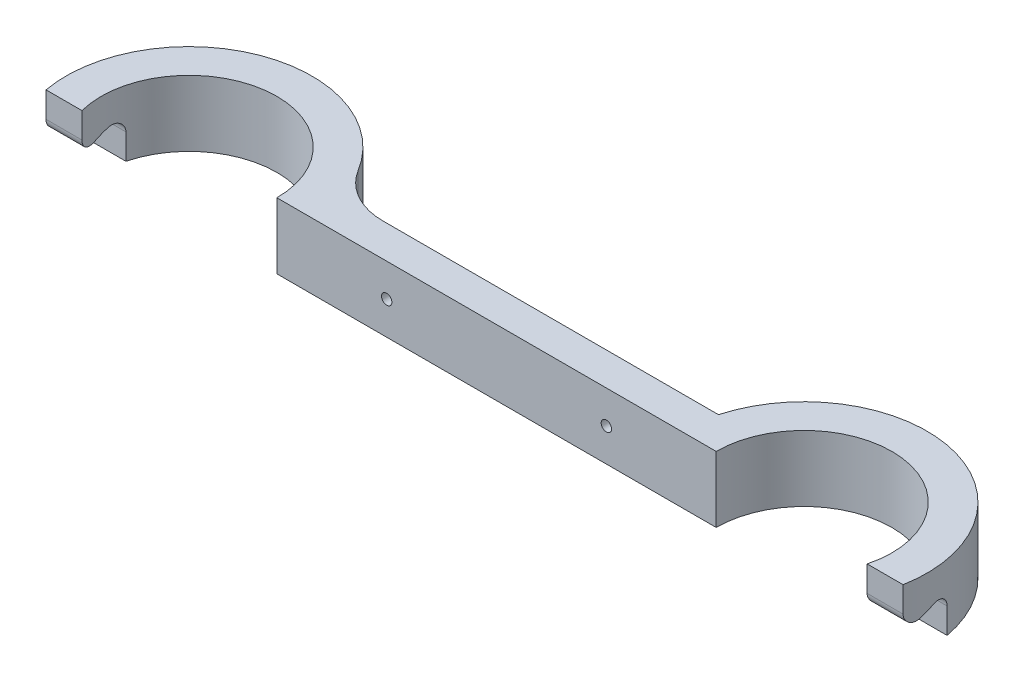
from build123d import *

# Parameters (mm, degrees)
BOSS_EXTRUDE1_DEPTH            = 19.05
FILLET1_R                      = 19.05
SKETCH2_R                      = 1.5
CUT_EXTRUDE1_DEPTH             = 129.572996096
BOSS_EXTRUDE2_REACH            = 132.835
BOSS_EXTRUDE2_END_RADIUS       = 25.4
CUT_EXTRUDE3_REACH             = 132.835
CUT_EXTRUDE3_DIRECTION_2_DEPTH = 131.83465787
CUT_EXTRUDE2_DEPTH             = 131.83465787
CUT_EXTRUDE2_DEPTH_BACK        = 131.83465787
FILLET2_R                      = 3.175
FILLET2_OF_MIRROR1_R           = 3.175
CUT_EXTRUDE4_DEPTH             = 131.834658007
CUT_EXTRUDE4_DEPTH_BACK        = 131.834658007


with BuildPart() as part:
    # Sketch1 → Boss-Extrude1 (new body)
    with BuildSketch(Plane(origin=(0, 0, 0), x_dir=(1, 0, 0), z_dir=(0, 1, 0))):
        with BuildLine():
            ThreePointArc((-54.639410761, 9.525), (-93.706612459, 35.233649778), (-124.46, 0))
            Line((-124.46, 0), (-114.3, 0))
            ThreePointArc((-114.3, 0), (-88.9, 25.4), (-63.5, 0))
            Line((-63.5, 0), (-53.34, 0))
            ThreePointArc((-53.34, 0), (-53.666350222, 4.806612459), (-54.639410761, 9.525))
        make_face()
        with BuildLine():
            Line((-53.34, 0), (0, 0))
            Line((0, 0), (0, 9.525))
            Line((0, 9.525), (-54.639410761, 9.525))
            ThreePointArc((-54.639410761, 9.525), (-53.666350222, 4.806612459), (-53.34, 0))
        make_face()
    boss_extrude1 = extrude(amount=BOSS_EXTRUDE1_DEPTH)

    # Fillet1
    fillet1_edges = [part.edges().sort_by_distance(p)[0] for p in [
        (-54.639410761, 9.525, -9.525),
    ]]
    fillet(fillet1_edges, radius=FILLET1_R)

    # Sketch2 → Cut-Extrude1 (cut, symmetric)
    with BuildSketch(Plane(origin=(0, 0, -9.525), x_dir=(-1, 0, 0), z_dir=(0, 0, -1))):
        with Locations((31.75, 9.525)):
            Circle(SKETCH2_R)
    cut_extrude1 = extrude(amount=CUT_EXTRUDE1_DEPTH, both=True, mode=Mode.SUBTRACT)

    # Boss-Extrude2: up to this cylinder (the profile starts outside it)
    boss_extrude2_end = Plane(origin=(-88.9, 11.6227675, 0), z_dir=(0, -1, 0)) * Cylinder(BOSS_EXTRUDE2_END_RADIUS, 323.358869, mode=Mode.PRIVATE)
    # Sketch3 → Boss-Extrude2 (add, up to the surface)
    with BuildSketch(Plane.ZY.offset(124.46), mode=Mode.PRIVATE) as boss_extrude2_sk1:
        Polygon((6.35, 19.05), (-6.35, 19.05), (-6.35, 12.065), (0, 9.525), (6.35, 9.525), align=None)
    boss_extrude2_tool1 = extrude(boss_extrude2_sk1.sketch, amount=-BOSS_EXTRUDE2_REACH, mode=Mode.PRIVATE) - boss_extrude2_end
    # Sketch3 → Boss-Extrude2 (add, up to the surface)
    with BuildSketch(Plane.ZY.offset(124.46), mode=Mode.PRIVATE) as boss_extrude2_sk2:
        Polygon((6.35, 6.985), (6.35, 9.525), (0, 9.525), align=None)
    boss_extrude2_tool2 = extrude(boss_extrude2_sk2.sketch, amount=-BOSS_EXTRUDE2_REACH, mode=Mode.PRIVATE) - boss_extrude2_end
    boss_extrude2 = boss_extrude2_tool1.solids().sort_by_distance((-124.46, 14.567202, 0.302381))[0] + boss_extrude2_tool2.solids().sort_by_distance((-124.46, 8.678333, 4.233333))[0]
    add(boss_extrude2)

    # Sketch3<3> → Cut-Extrude3 (cut, up to next)
    with BuildSketch(Plane.ZY.offset(124.46), mode=Mode.PRIVATE) as cut_extrude3_sk1:
        Polygon((-6.35, 0), (6.35, 0), (6.35, 6.985), (-6.35, 12.065), align=None)
    cut_extrude3_tool1 = extrude(cut_extrude3_sk1.sketch, amount=-CUT_EXTRUDE3_REACH, mode=Mode.PRIVATE) & part.part
    cut_extrude3 = cut_extrude3_tool1.solids().sort_by_distance((-124.46, 4.875389, -0.564444))[0]
    add(cut_extrude3, mode=Mode.SUBTRACT)

    # Sketch3<3> → Cut-Extrude3 direction 2 (cut)
    with BuildSketch(Plane.ZY.offset(124.46)):
        Polygon((-6.35, 0), (6.35, 0), (6.35, 6.985), (-6.35, 12.065), align=None)
    cut_extrude3_direction_2 = extrude(amount=CUT_EXTRUDE3_DIRECTION_2_DEPTH, mode=Mode.SUBTRACT)

    # Sketch4 → Cut-Extrude2 (cut, two sides: drawn at the far end of the back side and taken through both)
    with BuildSketch(Plane(origin=(0, 19.05, 0), x_dir=(1, 0, 0), z_dir=(0, 1, 0)).offset(-CUT_EXTRUDE2_DEPTH_BACK)):
        with BuildLine():
            Line((-124.46, -6.35), (-123.888442377, -6.35))
            ThreePointArc((-123.888442377, -6.35), (-124.316822351, -3.187835399), (-124.46, -2e-09))
            Line((-124.46, -2e-09), (-124.46, -6.35))
        make_face()
        with BuildLine():
            ThreePointArc((-124.46, -2e-09), (-124.316822351, 3.187835398), (-123.888442377, 6.35))
            Line((-123.888442377, 6.35), (-124.46, 6.35))
            Line((-124.46, 6.35), (-124.46, -2e-09))
        make_face()
    extrude(amount=CUT_EXTRUDE2_DEPTH + CUT_EXTRUDE2_DEPTH_BACK, mode=Mode.SUBTRACT)

    # Fillet2
    fillet2_edges = [part.edges().sort_by_distance(p)[0] for p in [
        (-118.690943313, 6.985, 6.35),
        (-118.690943313, 12.065, -6.35),
    ]]
    fillet(fillet2_edges, radius=FILLET2_R)

    # Mirror1: Boss-Extrude1, Cut-Extrude1, Boss-Extrude2, Cut-Extrude3, Cut-Extrude3 direction 2 across plane
    add(boss_extrude1.mirror(Plane(origin=(0, 19.05, 0), x_dir=(0, 0, 1), z_dir=(1, 0, 0))))
    add(cut_extrude1.mirror(Plane(origin=(0, 19.05, 0), x_dir=(0, 0, 1), z_dir=(1, 0, 0))), mode=Mode.SUBTRACT)
    add(boss_extrude2.mirror(Plane(origin=(0, 19.05, 0), x_dir=(0, 0, 1), z_dir=(1, 0, 0))))
    add(cut_extrude3.mirror(Plane(origin=(0, 19.05, 0), x_dir=(0, 0, 1), z_dir=(1, 0, 0))), mode=Mode.SUBTRACT)
    add(cut_extrude3_direction_2.mirror(Plane(origin=(0, 19.05, 0), x_dir=(0, 0, 1), z_dir=(1, 0, 0))), mode=Mode.SUBTRACT)

    # Fillet2 of Mirror1
    fillet2_of_mirror1_edges = [part.edges().sort_by_distance(p)[0] for p in [
        (118.690943313, 6.985, 6.35),
        (118.690943313, 12.065, -6.35),
    ]]
    fillet(fillet2_of_mirror1_edges, radius=FILLET2_OF_MIRROR1_R)

    # Sketch5 → Cut-Extrude4 (cut, two sides: drawn at the far end of the back side and taken through both)
    with BuildSketch(Plane(origin=(0, 19.05, 0), x_dir=(1, 0, 0), z_dir=(0, 1, 0)).offset(-CUT_EXTRUDE4_DEPTH_BACK)):
        with BuildLine():
            ThreePointArc((123.888442377, 6.35), (124.316822351, 3.187835399), (124.46, 0))
            Line((124.46, 0), (124.46, 6.35))
            Line((124.46, 6.35), (123.888442377, 6.35))
        make_face()
        with BuildLine():
            Line((124.46, -6.35), (124.46, 0))
            ThreePointArc((124.46, 0), (124.316822351, -3.187835399), (123.888442377, -6.35))
            Line((123.888442377, -6.35), (124.46, -6.35))
        make_face()
    extrude(amount=CUT_EXTRUDE4_DEPTH + CUT_EXTRUDE4_DEPTH_BACK, mode=Mode.SUBTRACT)


solid = part.part
